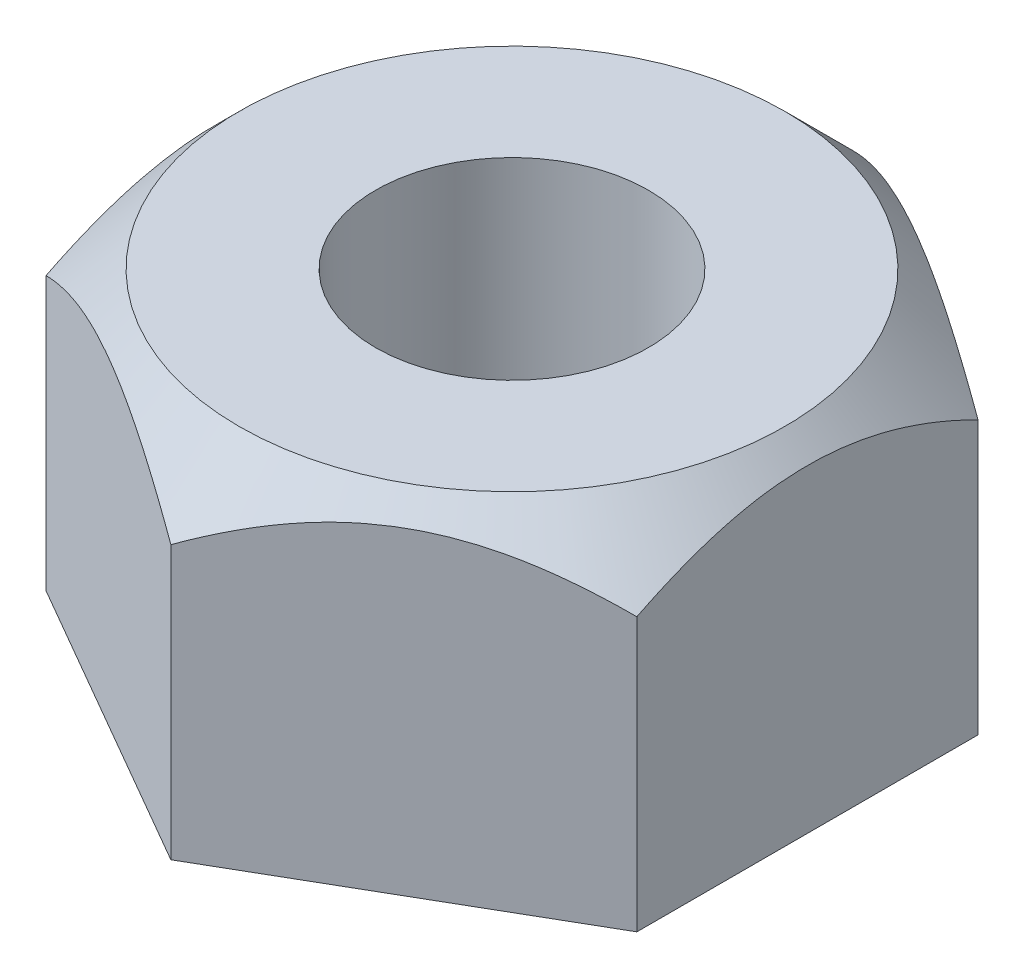
from build123d import *

# Parameters (mm, degrees)
SKETCH1_R           = 2
BOSS_EXTRUDE1_DEPTH = 5


with BuildPart() as part:
    # Sketch1 → Boss-Extrude1 (new body)
    with BuildSketch(Plane(origin=(0, 0, 0), x_dir=(1, 0, 0), z_dir=(0, 1, 0))):
        Polygon((0, 5), (-4.330127019, 2.5), (-4.330127019, -2.5), (0, -5), (4.330127019, -2.5), (4.330127019, 2.5), align=None)
        with Locations(Location((0, 0, 0), (0, 0, 270))):
            Circle(SKETCH1_R, mode=Mode.SUBTRACT)
    extrude(amount=BOSS_EXTRUDE1_DEPTH)

    # Sketch3 → Cut-Revolve1 (revolve, cut)
    with BuildSketch(Plane(origin=(0, 0, 0), x_dir=(0, 0, -1), z_dir=(1, 0, 0))):
        Polygon((4, 5), (5, 5), (5, 4), align=None)
    revolve(axis=Axis((0, 0, 0), (0, 1, 0)), mode=Mode.SUBTRACT)


solid = part.part
